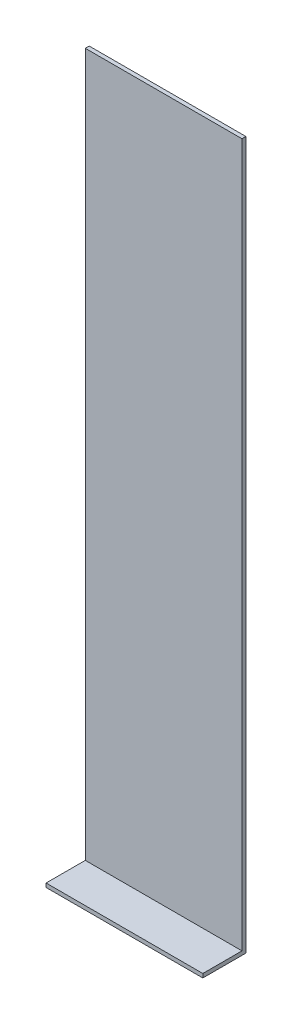
from build123d import *

# Parameters (mm, degrees)
BOSS_EXTRUDE1_DEPTH = 200


with BuildPart() as part:
    # Sketch1 → Boss-Extrude1 (new, symmetric)
    with BuildSketch(Plane(origin=(0, 0, 0), x_dir=(0, 0, -1), z_dir=(1, 0, 0))):
        Polygon((0, 0), (-100, 0), (-100, -10), (10, -10), (10, 1795.07), (0, 1795.07), align=None)
    extrude(amount=BOSS_EXTRUDE1_DEPTH, both=True)


solid = part.part
